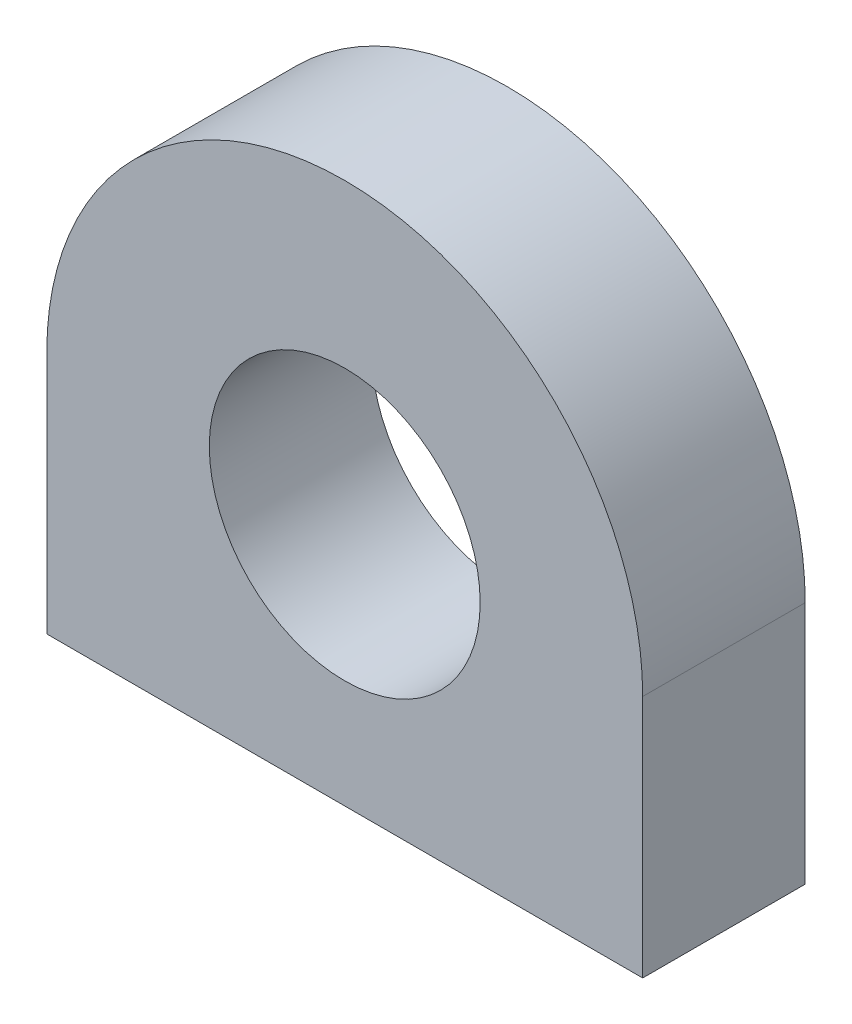
from build123d import *

# Parameters (mm, degrees)
SKETCH1_R           = 25
BOSS_EXTRUDE1_DEPTH = 30


with BuildPart() as part:
    # Sketch1 → Boss-Extrude1 (new body)
    with BuildSketch(Plane.XY):
        with BuildLine():
            Line((0, 0), (-110, 0))
            Line((-110, 0), (-110, 45))
            ThreePointArc((-110, 45), (-55, 100), (0, 45))
            Line((0, 45), (0, 0))
        make_face()
        with Locations((-55, 45)):
            Circle(SKETCH1_R, mode=Mode.SUBTRACT)
    extrude(amount=BOSS_EXTRUDE1_DEPTH)


solid = part.part
